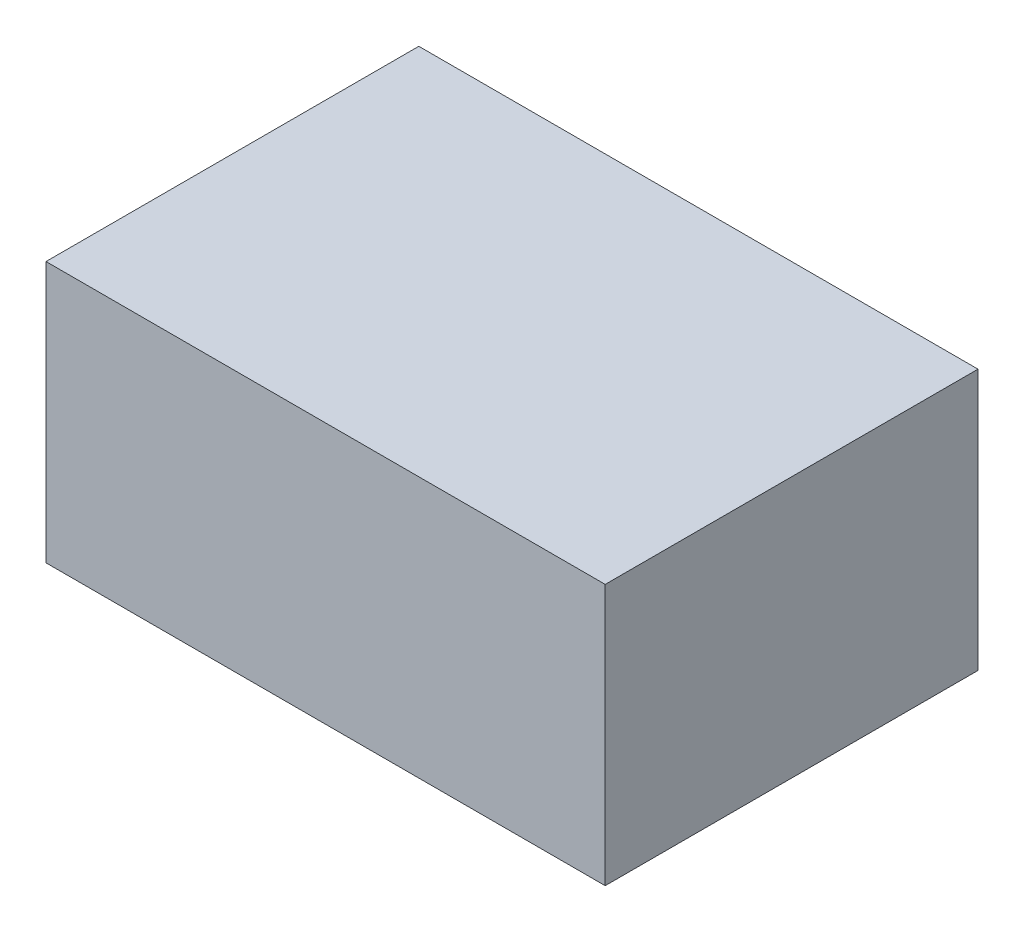
from build123d import *

# Parameters (mm, degrees)
SKETCH_1_W      = 1500
SKETCH_1_H      = 700
EXTRUDE_1_DEPTH = 1000


with BuildPart() as part:
    # Эскиз1 → Бобышка-Вытянуть1 (new body)
    with BuildSketch(Plane.XY):
        with Locations((682.313364055, 308.117273161)):
            Rectangle(SKETCH_1_W, SKETCH_1_H)
    extrude(amount=EXTRUDE_1_DEPTH)


solid = part.part
